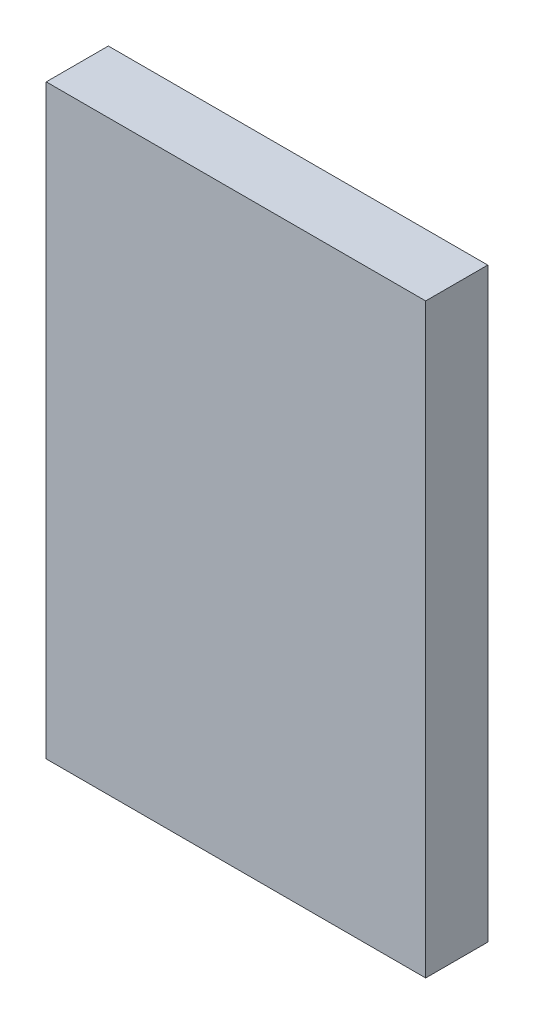
from build123d import *

# Parameters (mm, degrees)
ESQUISSE1_W        = 55
ESQUISSE1_H        = 85
BOSS_EXTRU_1_DEPTH = 9


with BuildPart() as part:
    # Esquisse1 → Boss.-Extru.1 (new body)
    with BuildSketch(Plane.XY):
        Rectangle(ESQUISSE1_W, ESQUISSE1_H)
    extrude(amount=BOSS_EXTRU_1_DEPTH)


solid = part.part
